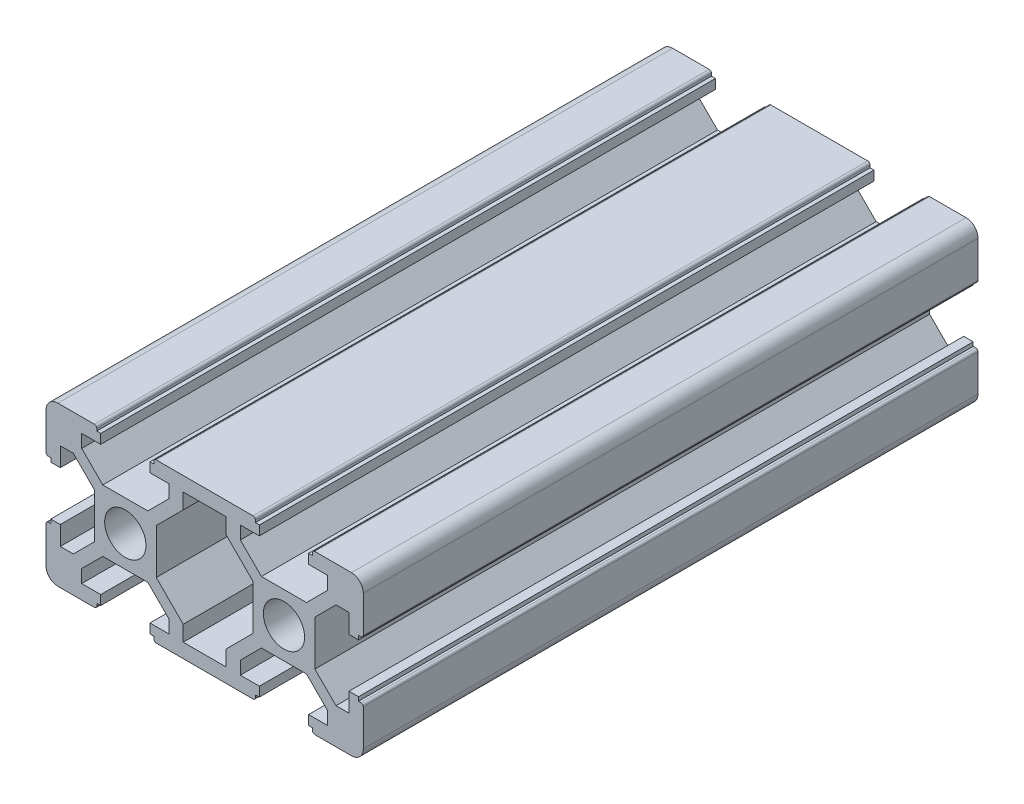
from build123d import *

# Parameters (mm, degrees)
SKETCH_1_R      = 2.6
EXTRUDE_1_DEPTH = 38.75
FILLET_1_R      = 1.5
FILLET_2_R      = 0.3


with BuildPart() as part:
    # 草图1 → 凸台-拉伸1 (new, symmetric)
    with BuildSketch(Plane.XY):
        Polygon((-13.9, 0), (-13.9, 2.839339828), (-16.560660172, 5.5), (-18.2, 5.5), (-18.2, 3.1), (-19.4, 3.1), (-19.4, 3.6), (-20, 3.6), (-20, 10), (-13.6, 10), (-13.6, 9.4), (-13.1, 9.4), (-13.1, 8.2), (-15.5, 8.2), (-15.5, 6.560660172), (-12.839339828, 3.9), (-7.160660172, 3.9), (-4.5, 6.560660172), (-4.5, 8.2), (-6.9, 8.2), (-6.9, 9.4), (-6.4, 9.4), (-6.4, 10), (6.4, 10), (6.4, 9.4), (6.9, 9.4), (6.9, 8.2), (4.5, 8.2), (4.5, 6.560660172), (7.160660172, 3.9), (12.839339828, 3.9), (15.5, 6.560660172), (15.5, 8.2), (13.1, 8.2), (13.1, 9.4), (13.6, 9.4), (13.6, 10), (20, 10), (20, 3.6), (19.4, 3.6), (19.4, 3.1), (18.2, 3.1), (18.2, 5.5), (16.560660172, 5.5), (13.9, 2.839339828), (13.9, 0), (13.9, -2.839339828), (16.560660172, -5.5), (18.2, -5.5), (18.2, -3.1), (19.4, -3.1), (19.4, -3.6), (20, -3.6), (20, -10), (13.6, -10), (13.6, -9.4), (13.1, -9.4), (13.1, -8.2), (15.5, -8.2), (15.5, -6.560660172), (12.839339828, -3.9), (7.160660172, -3.9), (4.5, -6.560660172), (4.5, -8.2), (6.9, -8.2), (6.9, -9.4), (6.4, -9.4), (6.4, -10), (-6.4, -10), (-6.4, -9.4), (-6.9, -9.4), (-6.9, -8.2), (-4.5, -8.2), (-4.5, -6.560660172), (-7.160660172, -3.9), (-12.839339828, -3.9), (-15.5, -6.560660172), (-15.5, -8.2), (-13.1, -8.2), (-13.1, -9.4), (-13.6, -9.4), (-13.6, -10), (-20, -10), (-20, -3.6), (-19.4, -3.6), (-19.4, -3.1), (-18.2, -3.1), (-18.2, -5.5), (-16.560660172, -5.5), (-13.9, -2.839339828), align=None)
        with Locations((-10, 0)):
            Circle(SKETCH_1_R, mode=Mode.SUBTRACT)
        with Locations(Location((10, 0, 0), (0, 0, 180))):
            Circle(SKETCH_1_R, mode=Mode.SUBTRACT)
        Polygon((-6.1, -2.839339828), (-6.1, 2.839339828), (-2.7, 6.239339828), (-2.7, 8.2), (2.7, 8.2), (2.7, 6.239339828), (6.1, 2.839339828), (6.1, -2.839339828), (2.7, -6.239339828), (2.7, -8.2), (-2.7, -8.2), (-2.7, -6.239339828), align=None, mode=Mode.SUBTRACT)
    extrude(amount=EXTRUDE_1_DEPTH, both=True)

    # 圆角1
    fillet_1_edges = [part.edges().sort_by_distance(p)[0] for p in [
        (-20, 10, 0),
        (20, 10, 0),
        (20, -10, 0),
        (-20, -10, 0),
    ]]
    fillet(fillet_1_edges, radius=FILLET_1_R)

    # 圆角2
    fillet_2_edges = [part.edges().sort_by_distance(p)[0] for p in [
        (-20, 3.6, 0),
        (-13.6, 10, 0),
        (-6.4, 10, 0),
        (6.4, 10, 0),
        (13.6, 10, 0),
        (20, 3.6, 0),
        (20, -3.6, 0),
        (13.6, -10, 0),
        (6.4, -10, 0),
        (-6.4, -10, 0),
        (-13.6, -10, 0),
        (-20, -3.6, 0),
    ]]
    fillet(fillet_2_edges, radius=FILLET_2_R)


solid = part.part
